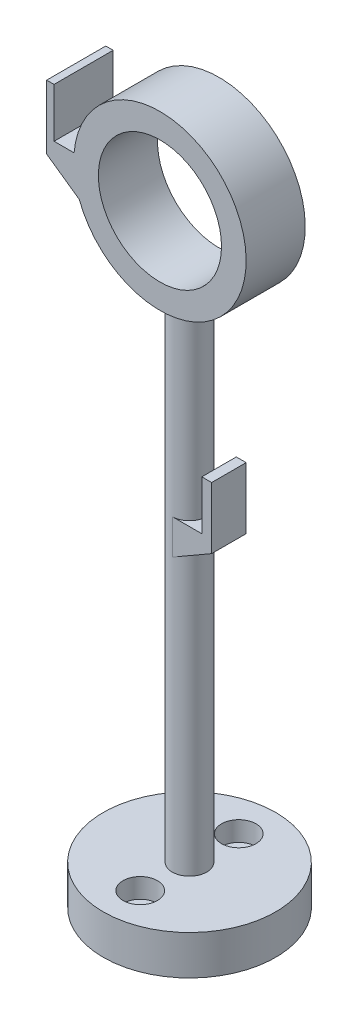
from build123d import *

# Parameters (mm, degrees)
ESBO_O1_R                = 17.5
RESSALTO_EXTRUS_O1_DEPTH = 8
ESBO_O2_R                = 3.5
RESSALTO_EXTRUS_O2_DEPTH = 100
ESBO_O3_R                = 3.5
CORTE_EXTRUS_O1_DEPTH    = 4
ESBO_O4_R                = 2
CORTE_EXTRUS_O2_DEPTH    = 4
ESBO_O5_R                = 17.5
ESBO_O5_R_2              = 12.5
RESSALTO_EXTRUS_O3_DEPTH = 6
ESBO_O8_W                = 7
ESBO_O8_H                = 2.5
RESSALTO_EXTRUS_O4_DEPTH = 8
ESBO_O9_W                = 2
ESBO_O9_H                = 7
RESSALTO_EXTRUS_O5_DEPTH = 10
RESSALTO_EXTRUS_O6_DEPTH = 8
ESBO_O15_W               = 1.5
ESBO_O15_H               = 12
RESSALTO_EXTRUS_O7_DEPTH = 10
RESSALTO_EXTRUS_O8_DEPTH = 6
RESSALTO_EXTRUS_O9_DEPTH = 3.5


with BuildPart() as part:
    # Esboço1 → Ressalto-extrusão1 (new body)
    with BuildSketch(Plane(origin=(0, 0, 0), x_dir=(1, 0, 0), z_dir=(0, 1, 0))):
        with Locations(Location((0, 0, 0), (0, 0, 270))):
            Circle(ESBO_O1_R)
    extrude(amount=RESSALTO_EXTRUS_O1_DEPTH)

    # Esboço2 → Ressalto-extrusão2 (add)
    with BuildSketch(Plane(origin=(0, 8, 0), x_dir=(1, 0, 0), z_dir=(0, 1, 0))):
        with Locations(Location((0, 0, 0), (0, 0, 270))):
            Circle(ESBO_O2_R)
    extrude(amount=RESSALTO_EXTRUS_O2_DEPTH)

    # Esboço3 → Corte-extrusão1 (cut)
    with BuildSketch(Plane(origin=(0, 8, 0), x_dir=(1, 0, 0), z_dir=(0, 1, 0))):
        with Locations(Location((0, 10, 0), (0, 0, 270))):
            Circle(ESBO_O3_R)
        with Locations(Location((0, -10, 0), (0, 0, 270))):
            Circle(ESBO_O3_R)
    extrude(amount=-CORTE_EXTRUS_O1_DEPTH, mode=Mode.SUBTRACT)

    # Esboço4 → Corte-extrusão2 (cut)
    with BuildSketch(Plane(origin=(0, 4, 0), x_dir=(1, 0, 0), z_dir=(0, 1, 0))):
        with Locations(Location((0, 10, 0), (0, 0, 270))):
            Circle(ESBO_O4_R)
        with Locations(Location((0, -10, 0), (0, 0, 270))):
            Circle(ESBO_O4_R)
    extrude(amount=-CORTE_EXTRUS_O2_DEPTH, mode=Mode.SUBTRACT)

    # Esboço8 → Ressalto-extrusão4 (add)
    with BuildSketch(Plane(origin=(0, 0, 0), x_dir=(0, 0, -1), z_dir=(1, 0, 0))):
        with Locations((0, 69.25)):
            Rectangle(ESBO_O8_W, ESBO_O8_H)
    extrude(amount=RESSALTO_EXTRUS_O4_DEPTH)

    # Esboço9 → Ressalto-extrusão5 (add)
    with BuildSketch(Plane(origin=(0, 70.5, 0), x_dir=(1, 0, 0), z_dir=(0, 1, 0))):
        with Locations((7, 0)):
            Rectangle(ESBO_O9_W, ESBO_O9_H)
    extrude(amount=RESSALTO_EXTRUS_O5_DEPTH)

    # Esboço17 → Ressalto-extrusão9 (add, symmetric)
    with BuildSketch(Plane.XY):
        Polygon((8, 68), (0, 63.381197846), (0, 68), align=None)
    extrude(amount=RESSALTO_EXTRUS_O9_DEPTH, both=True)


with BuildPart() as body_2:
    # Esboço5 → Ressalto-extrusão3 (new, symmetric)
    with BuildSketch(Plane.XY):
        with Locations((0, 125.5)):
            Circle(ESBO_O5_R)
        with Locations((0, 125.5)):
            Circle(ESBO_O5_R_2, mode=Mode.SUBTRACT)
    extrude(amount=RESSALTO_EXTRUS_O3_DEPTH, both=True)

    # Esboço14 → Ressalto-extrusão6 (add)
    with BuildSketch(Plane.ZY.offset(15)):
        Polygon((6, 125.5), (6, 127), (-6, 127), (-6, 124), (6, 124), align=None)
    extrude(amount=RESSALTO_EXTRUS_O6_DEPTH)

    # Esboço15 → Ressalto-extrusão7 (add)
    with BuildSketch(Plane(origin=(0, 127, 0), x_dir=(1, 0, 0), z_dir=(0, 1, 0))):
        with Locations((-22.25, 0)):
            Rectangle(ESBO_O15_W, ESBO_O15_H)
    extrude(amount=RESSALTO_EXTRUS_O7_DEPTH)

    # Esboço16 → Ressalto-extrusão8 (add, symmetric)
    with BuildSketch(Plane.XY):
        Polygon((-23, 124), (-16.378541302, 119.336122584), (-17.435595774, 124), align=None)
    extrude(amount=RESSALTO_EXTRUS_O8_DEPTH, both=True)


solid = Compound([part.part, body_2.part])
